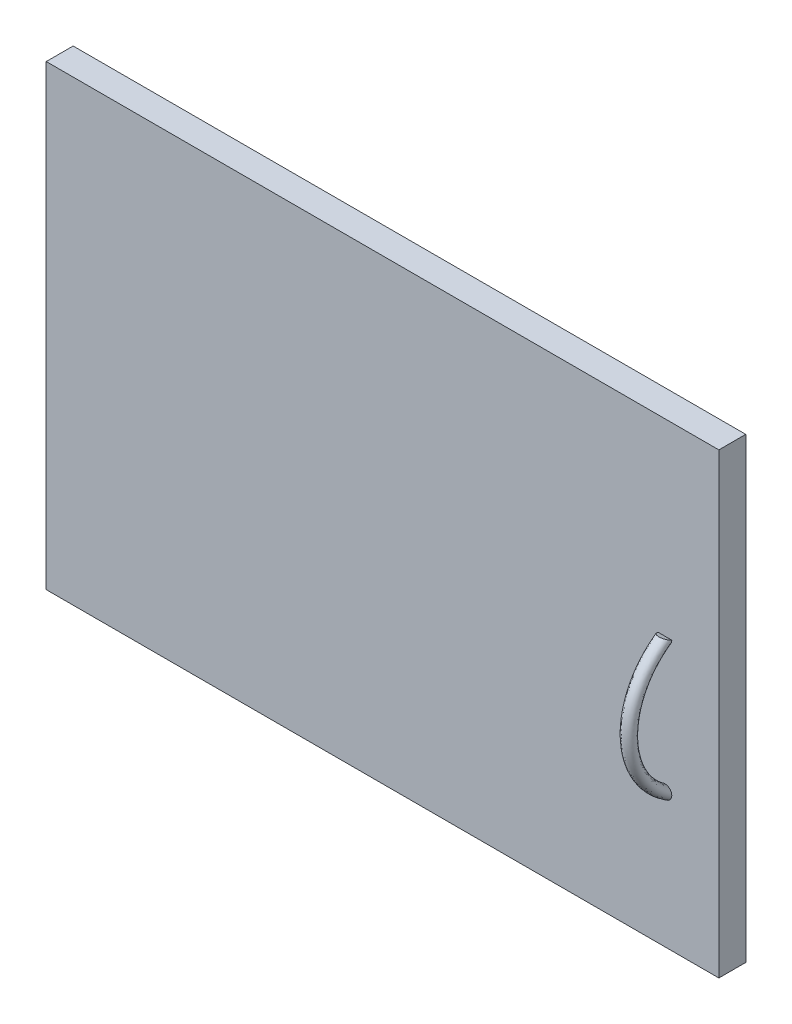
from build123d import *

# Parameters (mm, degrees)
SKETCH_1_W      = 25
SKETCH_1_H      = 17
EXTRUDE_1_DEPTH = 1
SKETCH_3_R      = 0.25


with BuildPart() as part:
    # 草圖1 → 填料-伸長1 (new body)
    with BuildSketch(Plane.XY):
        Rectangle(SKETCH_1_W, SKETCH_1_H)
    extrude(amount=EXTRUDE_1_DEPTH)

    # 掃出1: sweep along a path in 草圖4
    with BuildLine(Plane(origin=(10.5, 0, 0), x_dir=(0, 0, -1), z_dir=(1, 0, 0))) as sweep_1_path:
        ThreePointArc((-1, -3.5), (-2.341687605, -1), (-1, 1.5))
    # 草圖3 → 掃出1 (sweep)
    with BuildSketch(Plane.XY.offset(1)):
        with Locations((10.5, -3.5)):
            Circle(SKETCH_3_R)
    sweep(path=sweep_1_path.line)


solid = part.part
